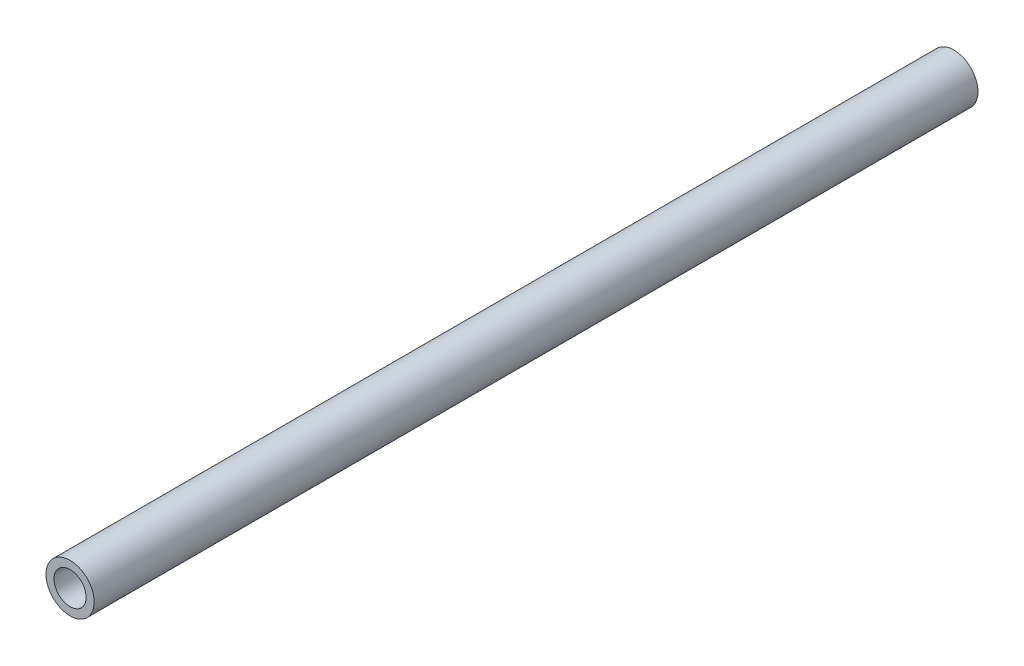
from build123d import *

# Parameters (mm, degrees)
SKETCH1_R           = 6
SKETCH1_R_2         = 4
BOSS_EXTRUDE1_DEPTH = 110


with BuildPart() as part:
    # Sketch1 → Boss-Extrude1 (new, symmetric)
    with BuildSketch(Plane.XY):
        Circle(SKETCH1_R)
        Circle(SKETCH1_R_2, mode=Mode.SUBTRACT)
    extrude(amount=BOSS_EXTRUDE1_DEPTH, both=True)


solid = part.part
